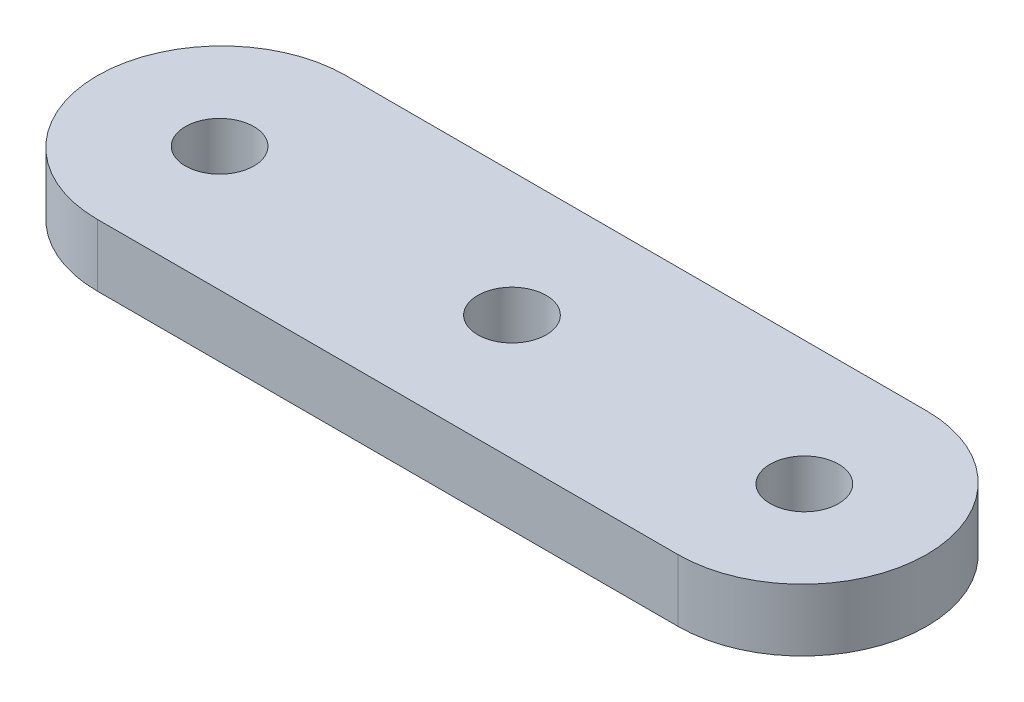
from build123d import *

# Parameters (mm, degrees)
BOSS_EXTRUDE1_DEPTH   = 3
M4X0_7_TAPPED_HOLE1_D = 3.3


with BuildPart() as part:
    # Sketch1 → Boss-Extrude1 (new body)
    with BuildSketch(Plane(origin=(0, 0, 0), x_dir=(1, 0, 0), z_dir=(0, 1, 0))):
        with BuildLine():
            Line((14, -6), (-14, -6))
            ThreePointArc((-14, -6), (-20, 0), (-14, 6))
            Line((-14, 6), (14, 6))
            ThreePointArc((14, 6), (20, 0), (14, -6))
        make_face()
    extrude(amount=-BOSS_EXTRUDE1_DEPTH)

    # M4x0.7 Tapped Hole1 (through all)
    with Locations(Plane(origin=(0, 0, 0), x_dir=(1, 0, 0), z_dir=(0, 1, 0))):
        with Locations((0, 0), (-14.1, 0), (14.1, 0)):
            Hole(M4X0_7_TAPPED_HOLE1_D / 2)


solid = part.part
